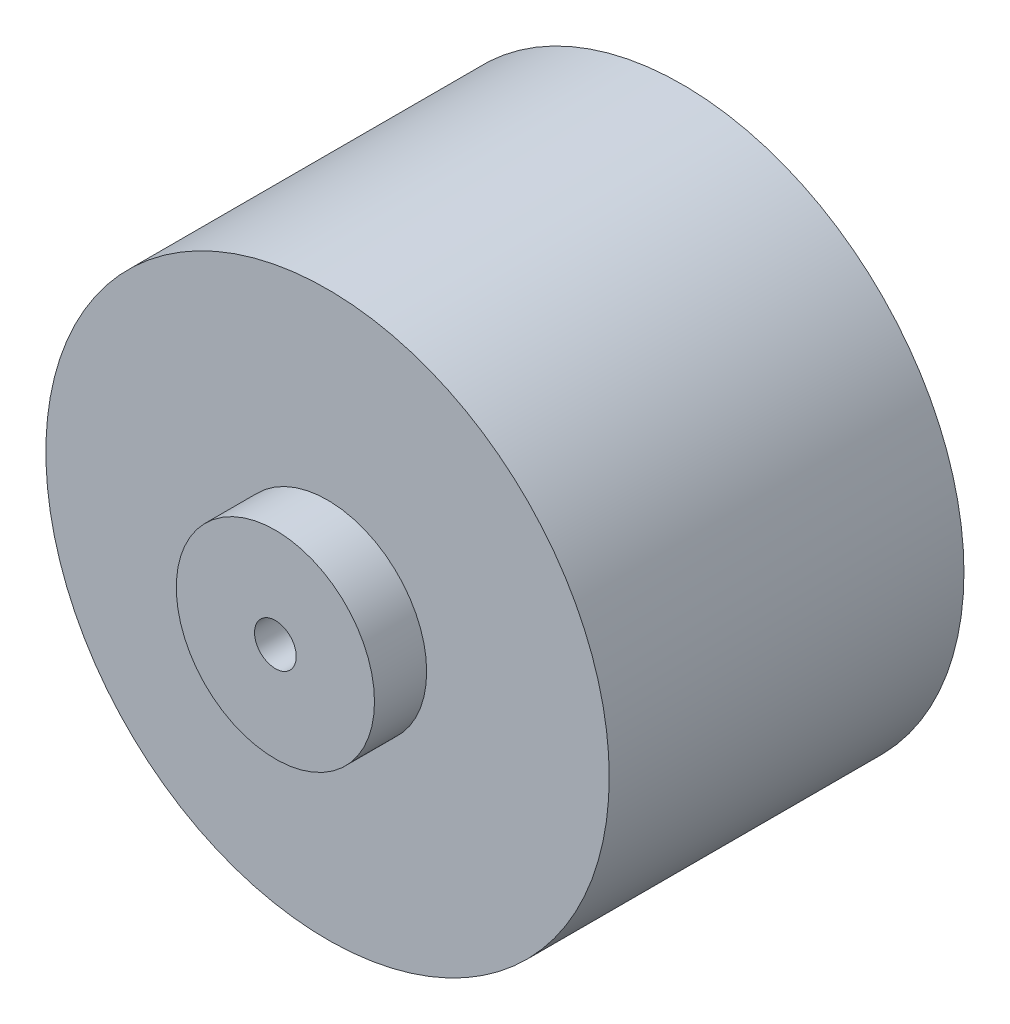
from build123d import *

# Parameters (mm, degrees)
SKETCH1_R           = 27
BOSS_EXTRUDE1_DEPTH = 34
SKETCH2_R           = 9.5
BOSS_EXTRUDE2_DEPTH = 5
SKETCH3_R           = 2
CUT_EXTRUDE1_DEPTH  = 30


with BuildPart() as part:
    # Sketch1 → Boss-Extrude1 (new body)
    with BuildSketch(Plane.XY):
        Circle(SKETCH1_R)
    extrude(amount=BOSS_EXTRUDE1_DEPTH)

    # Sketch2 → Boss-Extrude2 (add)
    with BuildSketch(Plane.XY.offset(34)):
        Circle(SKETCH2_R)
    extrude(amount=BOSS_EXTRUDE2_DEPTH)

    # Sketch3 → Cut-Extrude1 (cut)
    with BuildSketch(Plane.XY.offset(39)):
        Circle(SKETCH3_R)
    extrude(amount=-CUT_EXTRUDE1_DEPTH, mode=Mode.SUBTRACT)


solid = part.part
